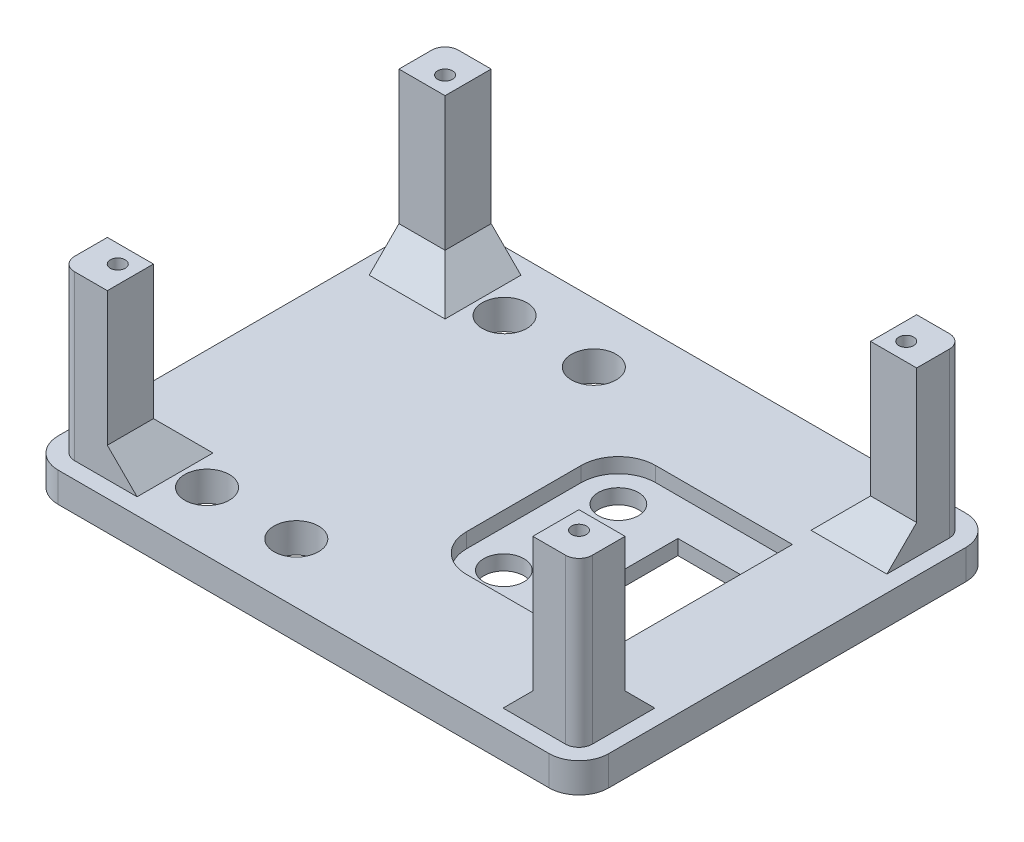
from build123d import *

# Parameters (mm, degrees)
SKETCH1_W           = 93.98
SKETCH1_H           = 71.12
BOSS_EXTRUDE1_DEPTH = 5.08
FILLET4_R           = 5.08
CUT_EXTRUDE5_REACH  = 119.967
SKETCH7_R           = 3.429
SKETCH7_W           = 13.208
SKETCH7_H           = 19.558
CUT_EXTRUDE7_DEPTH  = 2.54
CUT_EXTRUDE8_REACH  = 119.967
SKETCH8_R           = 3.81
SKETCH2_W           = 7.874
SKETCH2_H           = 7.874
BOSS_EXTRUDE3_DEPTH = 30.48
SKETCH10_R          = 1.27
CUT_EXTRUDE9_DEPTH  = 12.7
FILLET5_R           = 2.286
CHAMFER4_SIZE       = 5.08
SKETCH11_W          = 103.535361548
SKETCH11_H          = 78.086950251
CUT_EXTRUDE10_DEPTH = 2.54


with BuildPart() as part:
    # Sketch1 → Boss-Extrude1 (new body)
    with BuildSketch(Plane(origin=(0, 0, 0), x_dir=(1, 0, 0), z_dir=(0, 1, 0))):
        with Locations((46.99, 35.56)):
            Rectangle(SKETCH1_W, SKETCH1_H)
    extrude(amount=BOSS_EXTRUDE1_DEPTH)

    # Fillet4
    fillet4_edges = [part.edges().sort_by_distance(p)[0] for p in [
        (0, 2.54, -71.12),
        (93.98, 2.54, -71.12),
        (93.98, 2.54, 0),
        (0, 2.54, 0),
    ]]
    fillet(fillet4_edges, radius=FILLET4_R)

    # Sketch7 → Cut-Extrude5 (cut, up to next)
    with BuildSketch(Plane(origin=(0, 5.08, 0), x_dir=(1, 0, 0), z_dir=(0, 1, 0)), mode=Mode.PRIVATE) as cut_extrude5_sk1:
        with Locations(Location((55.372, 45.339, 0), (0, 0, 270))):
            Circle(SKETCH7_R)
    cut_extrude5_tool1 = extrude(cut_extrude5_sk1.sketch, amount=-CUT_EXTRUDE5_REACH, mode=Mode.PRIVATE) & part.part
    # Sketch7 → Cut-Extrude5 (cut, up to next)
    with BuildSketch(Plane(origin=(0, 5.08, 0), x_dir=(1, 0, 0), z_dir=(0, 1, 0)), mode=Mode.PRIVATE) as cut_extrude5_sk2:
        with Locations(Location((55.372, 25.781, 0), (0, 0, 270))):
            Circle(SKETCH7_R)
    cut_extrude5_tool2 = extrude(cut_extrude5_sk2.sketch, amount=-CUT_EXTRUDE5_REACH, mode=Mode.PRIVATE) & part.part
    # Sketch7 → Cut-Extrude5 (cut, up to next)
    with BuildSketch(Plane(origin=(0, 5.08, 0), x_dir=(1, 0, 0), z_dir=(0, 1, 0)), mode=Mode.PRIVATE) as cut_extrude5_sk3:
        with Locations((72.136, 35.56)):
            Rectangle(SKETCH7_W, SKETCH7_H)
    cut_extrude5_tool3 = extrude(cut_extrude5_sk3.sketch, amount=-CUT_EXTRUDE5_REACH, mode=Mode.PRIVATE) & part.part
    add(cut_extrude5_tool1.solids().sort_by_distance((55.372, 5.08, -45.339))[0], mode=Mode.SUBTRACT)
    add(cut_extrude5_tool2.solids().sort_by_distance((55.372, 5.08, -25.781))[0], mode=Mode.SUBTRACT)
    add(cut_extrude5_tool3.solids().sort_by_distance((72.136, 5.08, -35.56))[0], mode=Mode.SUBTRACT)

    # Sketch9 → Cut-Extrude7 (cut)
    with BuildSketch(Plane(origin=(0, 5.08, 0), x_dir=(1, 0, 0), z_dir=(0, 1, 0))):
        with BuildLine():
            Line((49.022, 45.339), (49.022, 25.781))
            ThreePointArc((49.022, 25.781), (50.881871939, 21.290871939), (55.372, 19.431))
            Line((55.372, 19.431), (65.532, 19.431))
            Line((65.532, 19.431), (78.74, 19.431))
            Line((78.74, 19.431), (78.74, 51.689))
            Line((78.74, 51.689), (65.532, 51.689))
            Line((65.532, 51.689), (55.372, 51.689))
            ThreePointArc((55.372, 51.689), (50.881871939, 49.829128061), (49.022, 45.339))
        make_face()
    extrude(amount=-CUT_EXTRUDE7_DEPTH, mode=Mode.SUBTRACT)

    # Sketch8 → Cut-Extrude8 (cut, up to next)
    with BuildSketch(Plane(origin=(0, 5.08, 0), x_dir=(1, 0, 0), z_dir=(0, 1, 0)), mode=Mode.PRIVATE) as cut_extrude8_sk1:
        with Locations(Location((20.32, 10.16, 0), (0, 0, 270))):
            Circle(SKETCH8_R)
    cut_extrude8_tool1 = extrude(cut_extrude8_sk1.sketch, amount=-CUT_EXTRUDE8_REACH, mode=Mode.PRIVATE) & part.part
    # Sketch8 → Cut-Extrude8 (cut, up to next)
    with BuildSketch(Plane(origin=(0, 5.08, 0), x_dir=(1, 0, 0), z_dir=(0, 1, 0)), mode=Mode.PRIVATE) as cut_extrude8_sk2:
        with Locations(Location((35.56, 10.16, 0), (0, 0, 270))):
            Circle(SKETCH8_R)
    cut_extrude8_tool2 = extrude(cut_extrude8_sk2.sketch, amount=-CUT_EXTRUDE8_REACH, mode=Mode.PRIVATE) & part.part
    # Sketch8 → Cut-Extrude8 (cut, up to next)
    with BuildSketch(Plane(origin=(0, 5.08, 0), x_dir=(1, 0, 0), z_dir=(0, 1, 0)), mode=Mode.PRIVATE) as cut_extrude8_sk3:
        with Locations(Location((35.56, 60.96, 0), (0, 0, 90))):
            Circle(SKETCH8_R)
    cut_extrude8_tool3 = extrude(cut_extrude8_sk3.sketch, amount=-CUT_EXTRUDE8_REACH, mode=Mode.PRIVATE) & part.part
    # Sketch8 → Cut-Extrude8 (cut, up to next)
    with BuildSketch(Plane(origin=(0, 5.08, 0), x_dir=(1, 0, 0), z_dir=(0, 1, 0)), mode=Mode.PRIVATE) as cut_extrude8_sk4:
        with Locations(Location((20.32, 60.96, 0), (0, 0, 90))):
            Circle(SKETCH8_R)
    cut_extrude8_tool4 = extrude(cut_extrude8_sk4.sketch, amount=-CUT_EXTRUDE8_REACH, mode=Mode.PRIVATE) & part.part
    add(cut_extrude8_tool1.solids().sort_by_distance((20.32, 5.08, -10.16))[0], mode=Mode.SUBTRACT)
    add(cut_extrude8_tool2.solids().sort_by_distance((35.56, 5.08, -10.16))[0], mode=Mode.SUBTRACT)
    add(cut_extrude8_tool3.solids().sort_by_distance((35.56, 5.08, -60.96))[0], mode=Mode.SUBTRACT)
    add(cut_extrude8_tool4.solids().sort_by_distance((20.32, 5.08, -60.96))[0], mode=Mode.SUBTRACT)

    # Sketch2 → Boss-Extrude3 (add)
    with BuildSketch(Plane(origin=(0, 5.08, 0), x_dir=(1, 0, 0), z_dir=(0, 1, 0))):
        with Locations((6.731, 64.389)):
            Rectangle(SKETCH2_W, SKETCH2_H)
        with Locations((87.249, 64.389)):
            Rectangle(SKETCH2_W, SKETCH2_H)
        with Locations((87.249, 6.731)):
            Rectangle(SKETCH2_W, SKETCH2_H)
        with Locations((6.731, 6.731)):
            Rectangle(SKETCH2_W, SKETCH2_H)
    extrude(amount=BOSS_EXTRUDE3_DEPTH)

    # Sketch10 → Cut-Extrude9 (cut)
    with BuildSketch(Plane(origin=(0, 35.56, 0), x_dir=(1, 0, 0), z_dir=(0, 1, 0))):
        with Locations(Location((7.62, 63.5, 0), (0, 0, 270))):
            Circle(SKETCH10_R)
        with Locations(Location((86.36, 63.5, 0), (0, 0, 90))):
            Circle(SKETCH10_R)
        with Locations(Location((86.36, 7.62, 0), (0, 0, 270))):
            Circle(SKETCH10_R)
        with Locations(Location((7.62, 7.62, 0), (0, 0, 90))):
            Circle(SKETCH10_R)
    extrude(amount=-CUT_EXTRUDE9_DEPTH, mode=Mode.SUBTRACT)

    # Fillet5
    fillet5_edges = [part.edges().sort_by_distance(p)[0] for p in [
        (2.794, 20.32, -68.326),
        (91.186, 20.32, -68.326),
        (91.186, 20.32, -2.794),
        (2.794, 20.32, -2.794),
    ]]
    fillet(fillet5_edges, radius=FILLET5_R)

    # Chamfer4
    chamfer4_edges = [part.edges().sort_by_distance(p)[0] for p in [
        (6.731, 5.08, -60.452),
        (10.668, 5.08, -64.389),
        (83.312, 5.08, -64.389),
        (87.249, 5.08, -60.452),
        (87.249, 5.08, -10.668),
        (83.312, 5.08, -6.731),
        (10.668, 5.08, -6.731),
        (6.731, 5.08, -10.668),
    ]]
    chamfer(chamfer4_edges, length=CHAMFER4_SIZE)

    # Sketch11 → Cut-Extrude10 (cut)
    with BuildSketch(Plane(origin=(0, 35.56, 0), x_dir=(1, 0, 0), z_dir=(0, 1, 0))):
        with Locations((47.570572121, 35.36647596)):
            Rectangle(SKETCH11_W, SKETCH11_H)
    extrude(amount=-CUT_EXTRUDE10_DEPTH, mode=Mode.SUBTRACT)


solid = part.part
